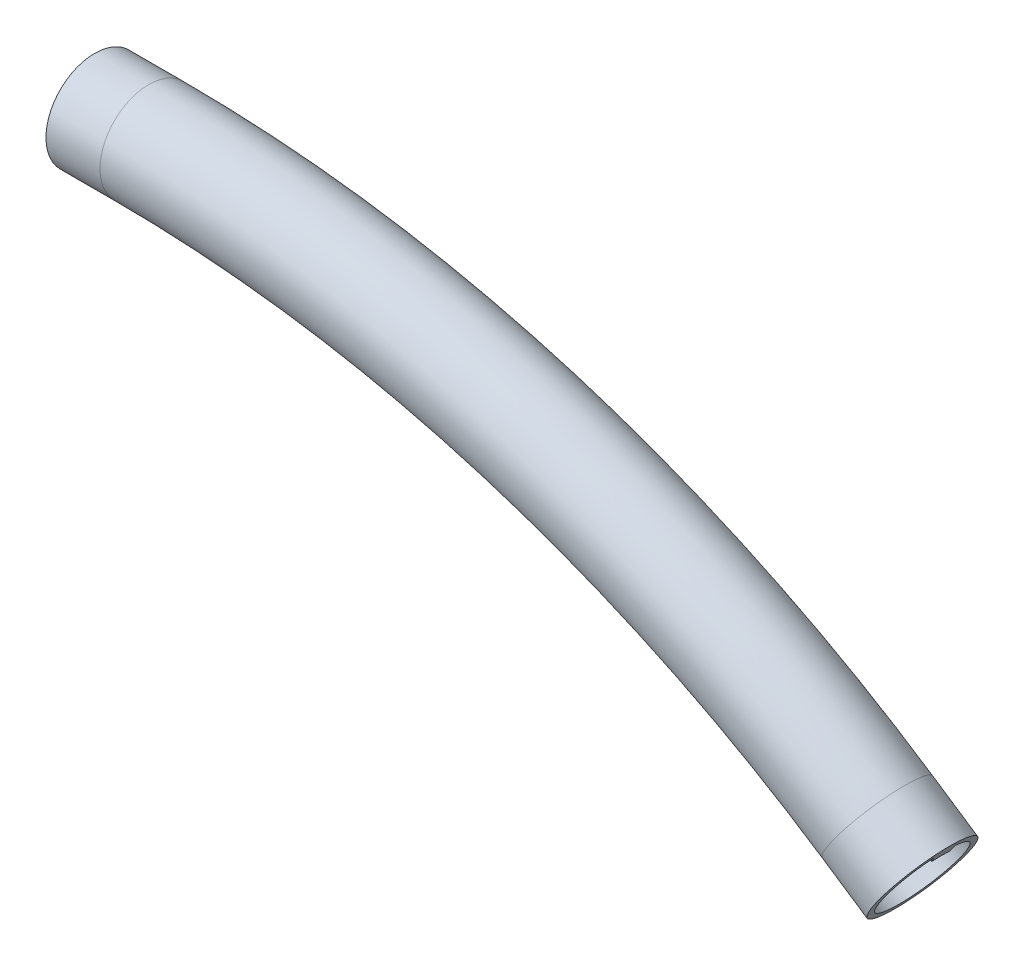
from build123d import *

# Parameters (mm, degrees)
SKETCH3_R           = 9
SKETCH3_R_2         = 7.75
BOSS_EXTRUDE3_DEPTH = 5
BOSS_EXTRUDE4_START = -5
BOSS_EXTRUDE4_DEPTH = 5


with BuildPart() as part:
    # Sweep1: sweep along a path in Sketch2path
    with BuildLine(Plane.XY) as sweep1_path:
        Line((0, 100), (10, 100))
        ThreePointArc((10, 100), (80.430596643, 89.552607894), (144.795757594, 59.110153969))
        Line((144.795757594, 59.110153969), (153.110453717, 53.554451639))
    # Sketch3 → Sweep1 (sweep)
    with BuildSketch(Plane(origin=(0, 0, 0), x_dir=(0, 0, -1), z_dir=(1, 0, 0))):
        with Locations((0, 100)):
            Circle(SKETCH3_R)
        with Locations((0, 100)):
            Circle(SKETCH3_R_2, mode=Mode.SUBTRACT)
    sweep(path=sweep1_path.line)

    # Sketch8 → Boss-Extrude3 (add)
    with BuildSketch(Plane(origin=(81.112712966, -54.197782068, 0), x_dir=(0, 0, -1), z_dir=(0.8314696123025445, -0.5555702330196034, 0))):
        with BuildLine():
            Line((-1.617619032, 135.629546005), (-2.0058476, 137.078434745))
            ThreePointArc((-2.0058476, 137.078434745), (0, 137.342509591), (2.0058476, 137.078434745))
            Line((2.0058476, 137.078434745), (1.617619032, 135.629546005))
            ThreePointArc((1.617619032, 135.629546005), (0, 135.842509591), (-1.617619032, 135.629546005))
        make_face()
    extrude(amount=-BOSS_EXTRUDE3_DEPTH)

    # Sketch9 → Boss-Extrude4 (add)
    with BuildSketch(Plane.ZY.offset(BOSS_EXTRUDE4_START)):
        with BuildLine():
            Line((-1.617619032, 106.037036414), (-2.0058476, 107.485925154))
            ThreePointArc((-2.0058476, 107.485925154), (0, 107.75), (2.0058476, 107.485925154))
            Line((2.0058476, 107.485925154), (1.617619032, 106.037036414))
            ThreePointArc((1.617619032, 106.037036414), (0, 106.25), (-1.617619032, 106.037036414))
        make_face()
    extrude(amount=BOSS_EXTRUDE4_DEPTH)


solid = part.part
